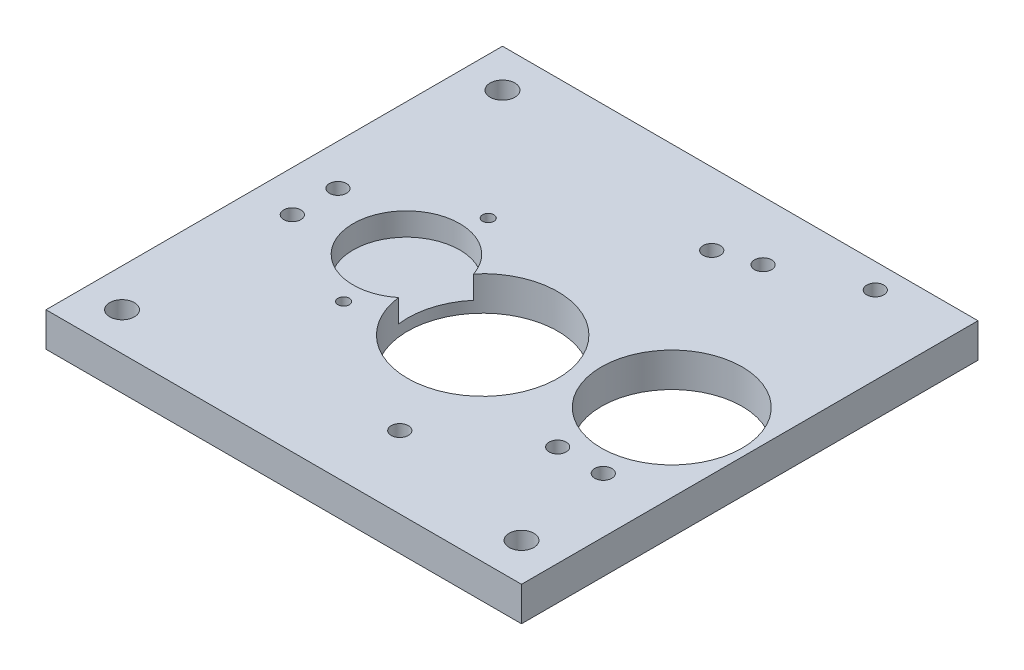
from build123d import *

# Parameters (mm, degrees)
SKETCH1_W                            = 125
SKETCH1_H                            = 120
TOP_BASE_DEPTH                       = 9
SKETCH5_R                            = 14
DRIVE_GEAR_EXTRUDE_CUT_DEPTH         = 6
SKETCH17_R                           = 19.75
INTERMEDIATE_GEAR_TOP_PART_CUT_DEPTH = 174.51080658
SKETCH8_R                            = 18.5
THUMB_EXTRUDE_CUT_DEPTH              = 174.51080658
SKETCH26_R                           = 1.5
STRING_HOLES_DEPTH                   = 174.51080658
THUMB_MOUNT_HOLES_R                  = 2.25
THUMB_MOUNT_HOLES_M4_DEPTH           = 174.51080658
FINGERS_MOUNT_HOLES_R                = 2.25
FINGERS_MOUNT_HOLES_M4_DEPTH         = 174.51080658
CONNECT_HOLES_POSITION_R             = 3.25
CONNECT_HOLES_M6_DEPTH               = 174.51080658
XL320_NUT_M4_DEPTH                   = 4


with BuildPart() as part:
    # Sketch1 → Top_Base (new body)
    with BuildSketch(Plane(origin=(0, 0, 0), x_dir=(1, 0, 0), z_dir=(0, 1, 0))):
        with Locations((62.5, 60)):
            Rectangle(SKETCH1_W, SKETCH1_H)
    extrude(amount=TOP_BASE_DEPTH)

    # Sketch5 → Drive_Gear_Extrude_Cut (cut)
    with BuildSketch(Plane(origin=(0, 9, 0), x_dir=(1, 0, 0), z_dir=(0, 1, 0))):
        with Locations(Location((34.75, 60, 0), (0, 0, 270))):
            Circle(SKETCH5_R)
    extrude(amount=-DRIVE_GEAR_EXTRUDE_CUT_DEPTH, mode=Mode.SUBTRACT)

    # Sketch17 → Intermediate_Gear_Top_Part_Cut (cut, through all)
    with BuildSketch(Plane(origin=(0, 9, 0), x_dir=(1, 0, 0), z_dir=(0, 1, 0))):
        with Locations(Location((63.146123438, 51.648511205, 0), (0, 0, 270))):
            Circle(SKETCH17_R)
    extrude(amount=-INTERMEDIATE_GEAR_TOP_PART_CUT_DEPTH, mode=Mode.SUBTRACT)

    # Sketch8 → Thumb_Extrude_Cut (cut, through all)
    with BuildSketch(Plane(origin=(0, 9, 0), x_dir=(1, 0, 0), z_dir=(0, 1, 0))):
        with Locations(Location((104.5, 60, 0), (0, 0, 270))):
            Circle(SKETCH8_R)
    extrude(amount=-THUMB_EXTRUDE_CUT_DEPTH, mode=Mode.SUBTRACT)

    # Sketch26 → String_Holes (cut, through all)
    with BuildSketch(Plane.XZ):
        with Locations(Location((37.25, -41, 0), (0, 0, 270))):
            Circle(SKETCH26_R)
        with Locations(Location((37.25, -79, 0), (0, 0, 90))):
            Circle(SKETCH26_R)
    extrude(amount=-STRING_HOLES_DEPTH, mode=Mode.SUBTRACT)

    # Thumb_Mount_Holes → Thumb_Mount_Holes_(M4) (cut, through all)
    with BuildSketch(Plane(origin=(0, 9, 0), x_dir=(1, 0, 0), z_dir=(0, 1, 0))):
        with Locations(Location((104.5, 113.5, 0), (0, 0, 270))):
            Circle(THUMB_MOUNT_HOLES_R)
        with Locations(Location((84, 104.5, 0), (0, 0, 270))):
            Circle(THUMB_MOUNT_HOLES_R)
        with Locations(Location((110.5, 36, 0), (0, 0, 270))):
            Circle(THUMB_MOUNT_HOLES_R)
        with Locations(Location((98.5, 36, 0), (0, 0, 90))):
            Circle(THUMB_MOUNT_HOLES_R)
    extrude(amount=-THUMB_MOUNT_HOLES_M4_DEPTH, mode=Mode.SUBTRACT)

    # Fingers_Mount_Holes → Fingers_Mount_Holes_(M4) (cut, through all)
    with BuildSketch(Plane(origin=(0, 9, 0), x_dir=(1, 0, 0), z_dir=(0, 1, 0))):
        with Locations(Location((74, 101, 0), (0, 0, 270))):
            Circle(FINGERS_MOUNT_HOLES_R)
        with Locations(Location((74, 19, 0), (0, 0, 90))):
            Circle(FINGERS_MOUNT_HOLES_R)
        with Locations(Location((10.75, 54, 0), (0, 0, 270))):
            Circle(FINGERS_MOUNT_HOLES_R)
        with Locations(Location((10.75, 66, 0), (0, 0, 90))):
            Circle(FINGERS_MOUNT_HOLES_R)
    extrude(amount=-FINGERS_MOUNT_HOLES_M4_DEPTH, mode=Mode.SUBTRACT)

    # Connect_Holes_Position → Connect_Holes_(M6) (cut, through all)
    with BuildSketch(Plane(origin=(0, 9, 0), x_dir=(1, 0, 0), z_dir=(0, 1, 0))):
        with Locations(Location((10, 110, 0), (0, 0, 270))):
            Circle(CONNECT_HOLES_POSITION_R)
        with Locations(Location((115, 10, 0), (0, 0, 270))):
            Circle(CONNECT_HOLES_POSITION_R)
        with Locations(Location((10, 10, 0), (0, 0, 270))):
            Circle(CONNECT_HOLES_POSITION_R)
    extrude(amount=-CONNECT_HOLES_M6_DEPTH, mode=Mode.SUBTRACT)

    # Sketch27 → XL320_Nut_(M4) (cut)
    with BuildSketch(Plane.XZ):
        Polygon((10.75, -49), (6.419872981, -51.5), (6.419872981, -56.5), (10.75, -59), (15.080127019, -56.5), (15.080127019, -51.5), align=None)
        Polygon((6.419872981, -63.5), (6.419872981, -68.5), (10.75, -71), (15.080127019, -68.5), (15.080127019, -63.5), (10.75, -61), align=None)
        Polygon((102.830127019, -38.5), (102.830127019, -33.5), (98.5, -31), (94.169872981, -33.5), (94.169872981, -38.5), (98.5, -41), align=None)
        Polygon((114.830127019, -33.5), (110.5, -31), (106.169872981, -33.5), (106.169872981, -38.5), (110.5, -41), (114.830127019, -38.5), align=None)
    extrude(amount=-XL320_NUT_M4_DEPTH, mode=Mode.SUBTRACT)


solid = part.part
